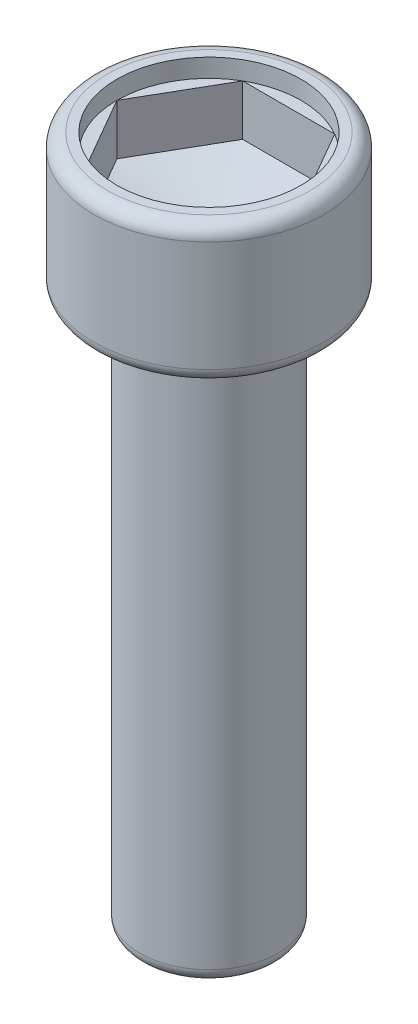
from build123d import *

# Parameters (mm, degrees)
SKETCH1_R           = 2.5
BOSS_EXTRUDE1_DEPTH = 3
CUT_EXTRUDE1_DEPTH  = 1.5
CUT_EXTRUDE2_START  = 1.5
SKETCH5_R           = 2
CUT_EXTRUDE2_DEPTH  = 0.4
SKETCH7_R           = 1.5
BOSS_EXTRUDE2_DEPTH = 12
FILLET1_R           = 0.3
FILLET2_R           = 0.3


with BuildPart() as part:
    # Sketch1 → Boss-Extrude1 (new body)
    with BuildSketch(Plane(origin=(0, 0, 0), x_dir=(1, 0, 0), z_dir=(0, 1, 0))):
        with Locations(Location((0, 0, 0), (0, 0, 270))):
            Circle(SKETCH1_R)
    extrude(amount=BOSS_EXTRUDE1_DEPTH)

    # Sketch2 → Cut-Extrude1 (cut)
    with BuildSketch(Plane(origin=(0, 3, 0), x_dir=(1, 0, 0), z_dir=(0, 1, 0))):
        Polygon((2, 0), (1, 1.732050808), (-1, 1.732050808), (-2, 0), (-1, -1.732050808), (1, -1.732050808), align=None)
    extrude(amount=-CUT_EXTRUDE1_DEPTH, mode=Mode.SUBTRACT)

    # Sketch5 → Cut-Extrude2 (cut)
    with BuildSketch(Plane(origin=(0, 1.5, 0), x_dir=(1, 0, 0), z_dir=(0, 1, 0)).offset(CUT_EXTRUDE2_START)):
        with Locations(Location((0, 0, 0), (0, 0, 270))):
            Circle(SKETCH5_R)
    extrude(amount=-CUT_EXTRUDE2_DEPTH, mode=Mode.SUBTRACT)

    # Cut-Extrude3 cone 1 section (through the dimple's axis) → Cut-Extrude3 (revolve, cut)
    with BuildSketch(Plane(origin=(0, 1.5, 0), x_dir=(0, 0, 1), z_dir=(1, 0, 0))):
        Polygon((0, 0), (2, 0), (0, 0.498656006), align=None)
    revolve(axis=Axis((0, 1.5, 0), (0, -1, 0)), mode=Mode.SUBTRACT)

    # Sketch7 → Boss-Extrude2 (add)
    with BuildSketch(Plane.XZ):
        with Locations(Location((0, 0, 0), (0, 0, 270))):
            Circle(SKETCH7_R)
    extrude(amount=BOSS_EXTRUDE2_DEPTH)

    # Fillet1
    fillet1_edges = [part.edges().sort_by_distance(p)[0] for p in [
        (0, 0, -2.5),
        (0, 3, -2.5),
    ]]
    fillet(fillet1_edges, radius=FILLET1_R)

    # Fillet2
    fillet2_edges = [part.edges().sort_by_distance(p)[0] for p in [
        (0, -12, 1.5),
    ]]
    fillet(fillet2_edges, radius=FILLET2_R)


solid = part.part
